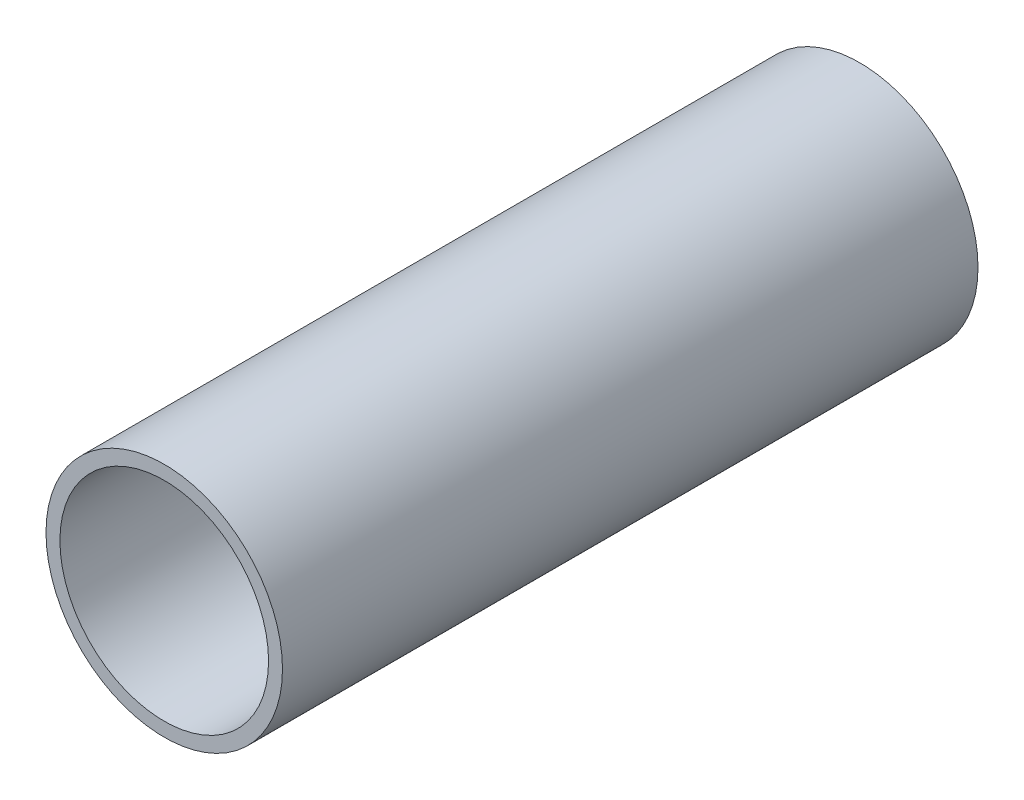
from build123d import *

# Parameters (mm, degrees)
SKETCH1_R           = 34
SKETCH1_R_2         = 30
BOSS_EXTRUDE1_DEPTH = 200


with BuildPart() as part:
    # Sketch1 → Boss-Extrude1 (new body)
    with BuildSketch(Plane.XY):
        Circle(SKETCH1_R)
        Circle(SKETCH1_R_2, mode=Mode.SUBTRACT)
    extrude(amount=BOSS_EXTRUDE1_DEPTH)


solid = part.part
